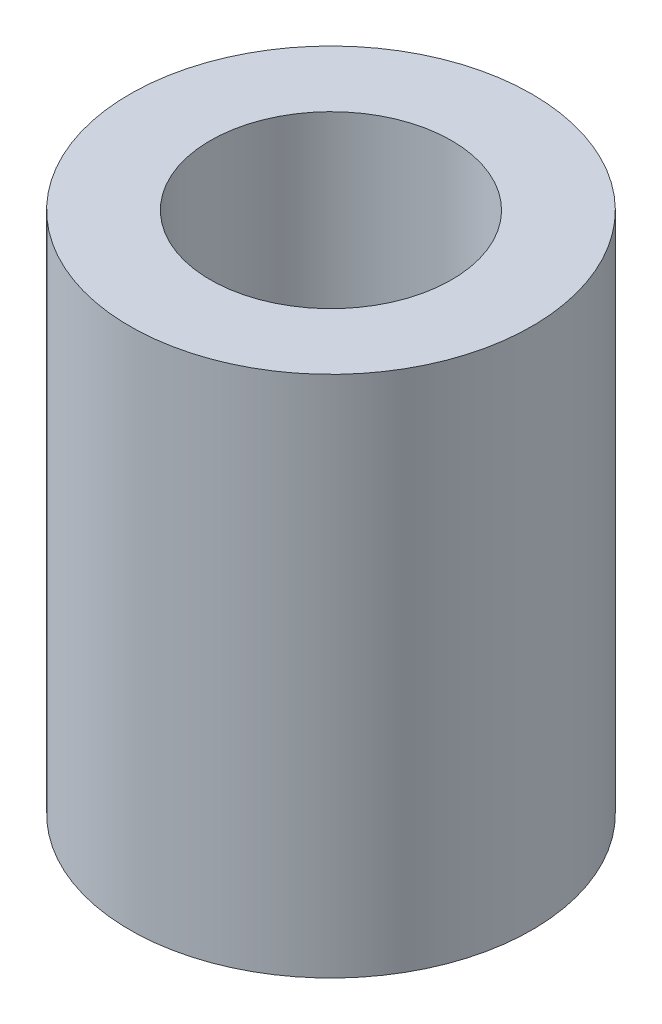
from build123d import *

# Parameters (mm, degrees)
SKETCH1_R           = 5
SKETCH1_R_2         = 3
BOSS_EXTRUDE1_DEPTH = 13


with BuildPart() as part:
    # Sketch1 → Boss-Extrude1 (new body)
    with BuildSketch(Plane(origin=(0, 0, 0), x_dir=(1, 0, 0), z_dir=(0, 1, 0))):
        with Locations(Location((0, 0, 0), (0, 0, 90))):
            Circle(SKETCH1_R)
        with Locations(Location((0, 0, 0), (0, 0, 90))):
            Circle(SKETCH1_R_2, mode=Mode.SUBTRACT)
    extrude(amount=BOSS_EXTRUDE1_DEPTH)


solid = part.part
